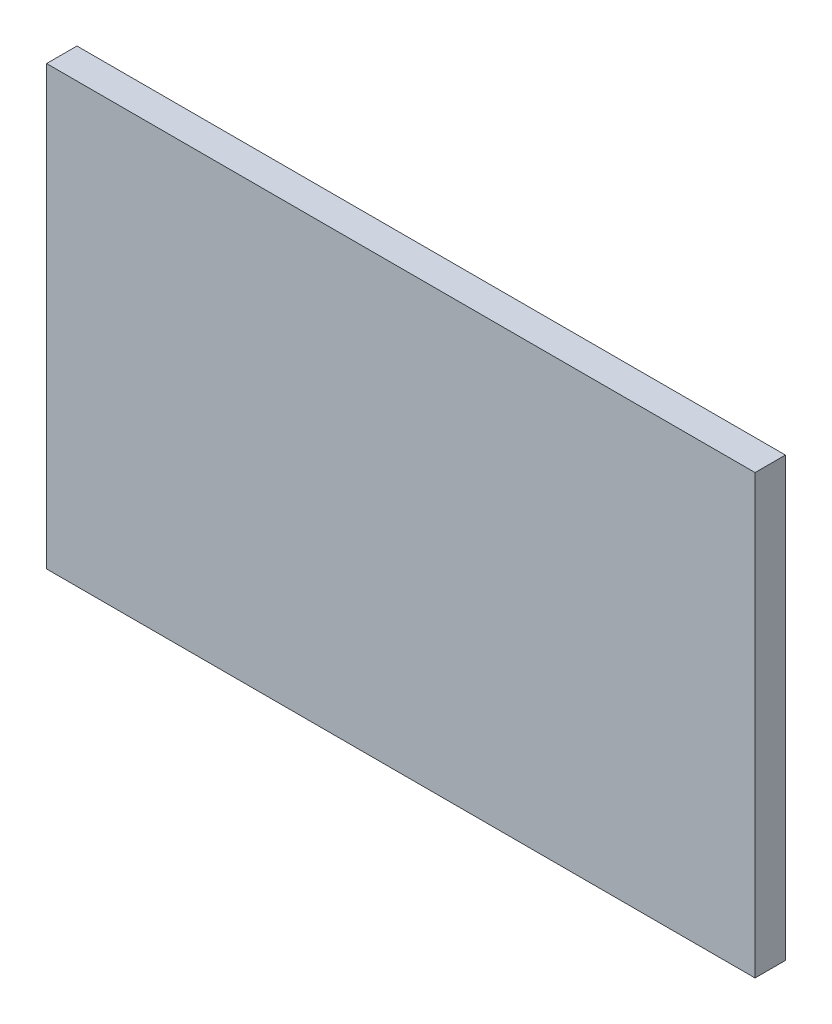
from build123d import *

# Parameters (mm, degrees)
PCB_SK1_W   = 28
PCB_SK1_H   = 17.3
PCB_DEPTH   = 1.2
USB_C_SK2_W = 7.35
USB_C_SK2_H = 8.94
USB_C_DEPTH = 3.26
CHIP_SK3_W  = 5
CHIP_SK3_H  = 5
CHIP_DEPTH  = 1.6


with BuildPart() as part:
    # PCB_Sk1 → PCB (new body)
    with BuildSketch(Plane.XY.offset(-3.17)):
        with Locations((-33.2, -18.55)):
            Rectangle(PCB_SK1_W, PCB_SK1_H)
    extrude(amount=-PCB_DEPTH)

    # USB_C_Sk2 → USB_C (add)
    with BuildSketch(Plane.XY.offset(-4.37)):
        with Locations((-44.325, -18.55)):
            Rectangle(USB_C_SK2_W, USB_C_SK2_H)
    extrude(amount=-USB_C_DEPTH)

    # Chip_Sk3 → Chip (add)
    with BuildSketch(Plane.XY.offset(-4.37)):
        with Locations((-33.7, -18.55)):
            Rectangle(CHIP_SK3_W, CHIP_SK3_H)
    extrude(amount=-CHIP_DEPTH)


solid = part.part
